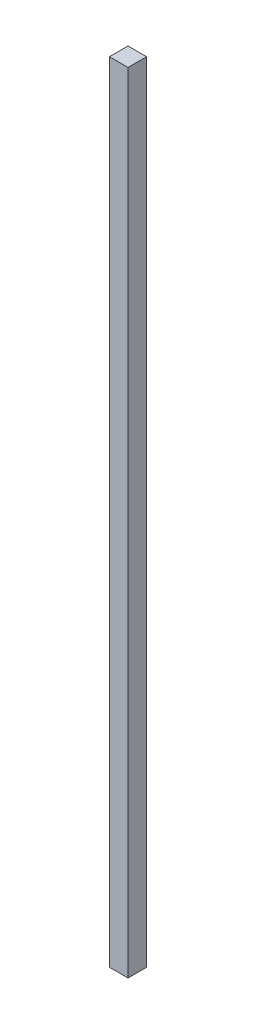
from build123d import *

# Parameters (mm, degrees)
SKETCH1_W           = 20
SKETCH1_H           = 20
BOSS_EXTRUDE1_DEPTH = 850


with BuildPart() as part:
    # Sketch1 → Boss-Extrude1 (new body)
    with BuildSketch(Plane(origin=(0, 0, 0), x_dir=(1, 0, 0), z_dir=(0, 1, 0))):
        Rectangle(SKETCH1_W, SKETCH1_H)
    extrude(amount=BOSS_EXTRUDE1_DEPTH)


solid = part.part
